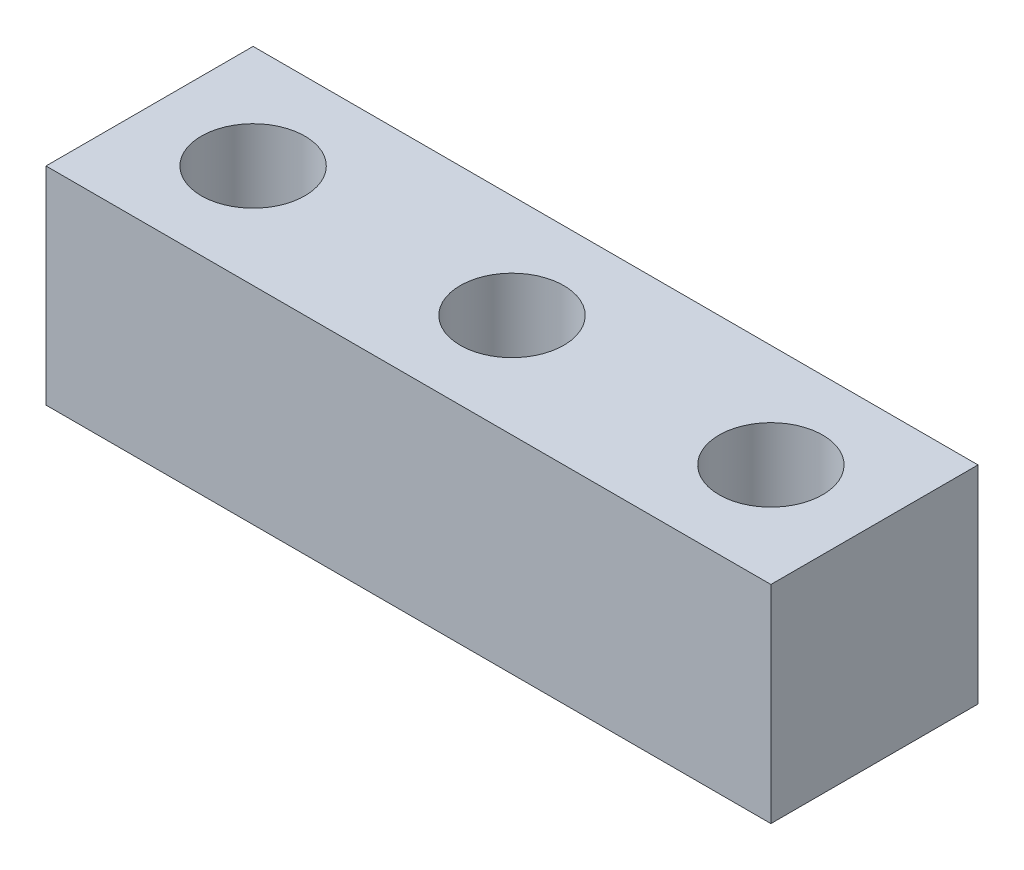
from build123d import *

# Parameters (mm, degrees)
SKETCH1_W           = 44.45
SKETCH1_H           = 12.7
BOSS_EXTRUDE1_DEPTH = 12.7
SKETCH2_R           = 3.175
CUT_EXTRUDE1_DEPTH  = 12.7
SKETCH3_R           = 3.175
CUT_EXTRUDE2_DEPTH  = 12.7


with BuildPart() as part:
    # Sketch1 → Boss-Extrude1 (new body)
    with BuildSketch(Plane(origin=(0, 0, 0), x_dir=(1, 0, 0), z_dir=(0, 1, 0))):
        Rectangle(SKETCH1_W, SKETCH1_H)
    extrude(amount=BOSS_EXTRUDE1_DEPTH)

    # Sketch2 → Cut-Extrude1 (cut)
    with BuildSketch(Plane(origin=(0, 12.7, 0), x_dir=(1, 0, 0), z_dir=(0, 1, 0))):
        with Locations(Location((-15.875, 0, 0), (0, 0, 270))):
            Circle(SKETCH2_R)
        with Locations(Location((15.875, 0, 0), (0, 0, 270))):
            Circle(SKETCH2_R)
    extrude(amount=-CUT_EXTRUDE1_DEPTH, mode=Mode.SUBTRACT)

    # Sketch3 → Cut-Extrude2 (cut)
    with BuildSketch(Plane(origin=(0, 12.7, 0), x_dir=(1, 0, 0), z_dir=(0, 1, 0))):
        with Locations(Location((0, 0, 0), (0, 0, 270))):
            Circle(SKETCH3_R)
    extrude(amount=-CUT_EXTRUDE2_DEPTH, mode=Mode.SUBTRACT)


solid = part.part
